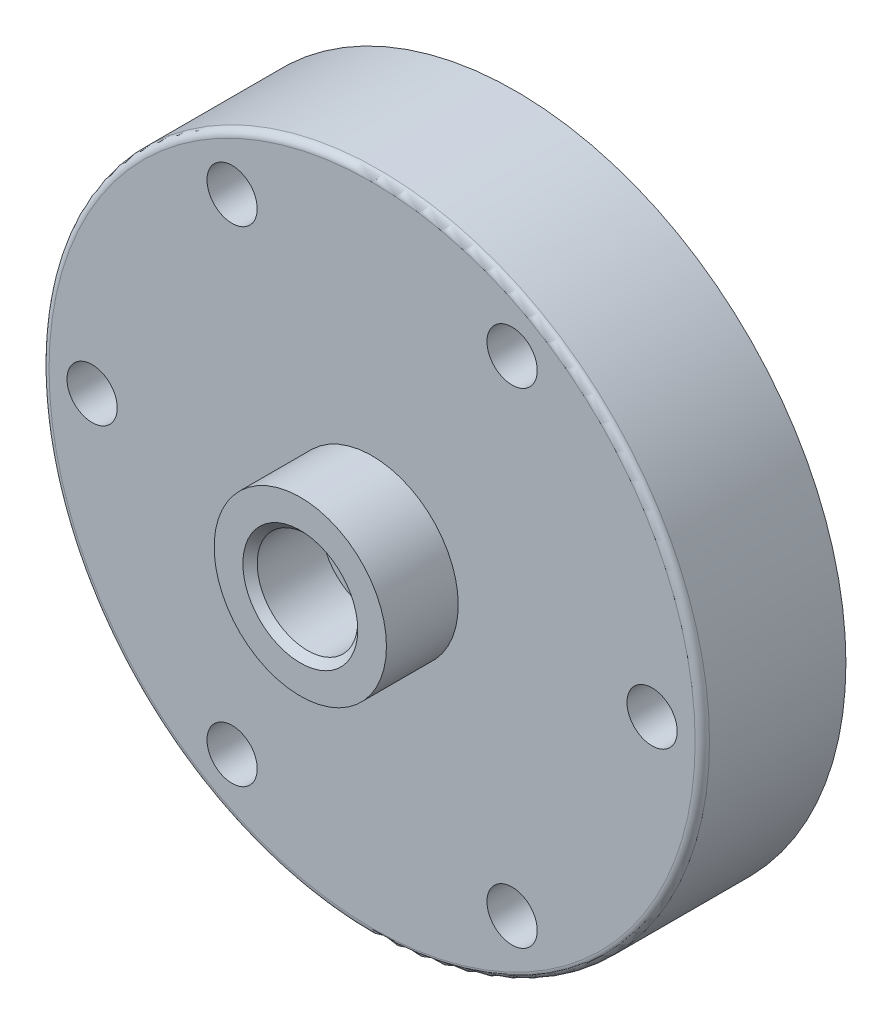
from build123d import *

# Parameters (mm, degrees)
SKETCH1_R           = 46
BOSS_EXTRUDE1_DEPTH = 10
SKETCH2_R           = 12
BOSS_EXTRUDE2_DEPTH = 10
SKETCH3_R           = 3.5
CUT_EXTRUDE1_DEPTH  = 69.058798109
FILLET2_R           = 1
SKETCH4_R           = 33
CUT_EXTRUDE2_DEPTH  = 14
SKETCH9_R           = 7
CUT_EXTRUDE3_DEPTH  = 10
SKETCH10_R          = 2.5
CUT_EXTRUDE4_DEPTH  = 69.058798109
CHAMFER1_SIZE       = 1
SKETCH12_R          = 4
CUT_EXTRUDE7_DEPTH  = 100


with BuildPart() as part:
    # Sketch1 → Boss-Extrude1 (new, symmetric)
    with BuildSketch(Plane.XY):
        Circle(SKETCH1_R)
    extrude(amount=BOSS_EXTRUDE1_DEPTH, both=True)

    # Sketch2 → Boss-Extrude2 (add)
    with BuildSketch(Plane.XY.offset(10)):
        Circle(SKETCH2_R)
    extrude(amount=BOSS_EXTRUDE2_DEPTH)

    # Sketch3 → Cut-Extrude1 (cut, through all)
    with BuildSketch(Plane.XY.offset(10)):
        with Locations((39, 0)):
            Circle(SKETCH3_R)
        with Locations((19.5, -33.774990748)):
            Circle(SKETCH3_R)
        with Locations((-19.5, -33.774990748)):
            Circle(SKETCH3_R)
        with Locations((-39, 0)):
            Circle(SKETCH3_R)
        with Locations((-19.5, 33.774990748)):
            Circle(SKETCH3_R)
        with Locations((19.5, 33.774990748)):
            Circle(SKETCH3_R)
    extrude(amount=-CUT_EXTRUDE1_DEPTH, mode=Mode.SUBTRACT)

    # Fillet2
    fillet2_edges = [part.edges().sort_by_distance(p)[0] for p in [
        (-46, 0, 10),
    ]]
    fillet(fillet2_edges, radius=FILLET2_R)

    # Sketch4 → Cut-Extrude2 (cut)
    with BuildSketch(Plane(origin=(0, 0, -10), x_dir=(-1, 0, 0), z_dir=(0, 0, -1))):
        Circle(SKETCH4_R)
    extrude(amount=-CUT_EXTRUDE2_DEPTH, mode=Mode.SUBTRACT)

    # Sketch9 → Cut-Extrude3 (cut)
    with BuildSketch(Plane.XY.offset(20)):
        Circle(SKETCH9_R)
    extrude(amount=-CUT_EXTRUDE3_DEPTH, mode=Mode.SUBTRACT)

    # Sketch10 → Cut-Extrude4 (cut, through all)
    with BuildSketch(Plane.XY.offset(10)):
        Circle(SKETCH10_R)
    extrude(amount=-CUT_EXTRUDE4_DEPTH, mode=Mode.SUBTRACT)

    # Chamfer1
    chamfer1_edges = [part.edges().sort_by_distance(p)[0] for p in [
        (-7, 0, 20),
    ]]
    chamfer(chamfer1_edges, length=CHAMFER1_SIZE)

    # Sketch12 → Cut-Extrude7 (cut)
    with BuildSketch(Plane(origin=(0, 0, 0), x_dir=(1, 0, 0), z_dir=(0, 1, 0))):
        with Locations(Location((0, 2, 0), (0, 0, 270))):
            Circle(SKETCH12_R)
    extrude(amount=-CUT_EXTRUDE7_DEPTH, mode=Mode.SUBTRACT)


solid = part.part
